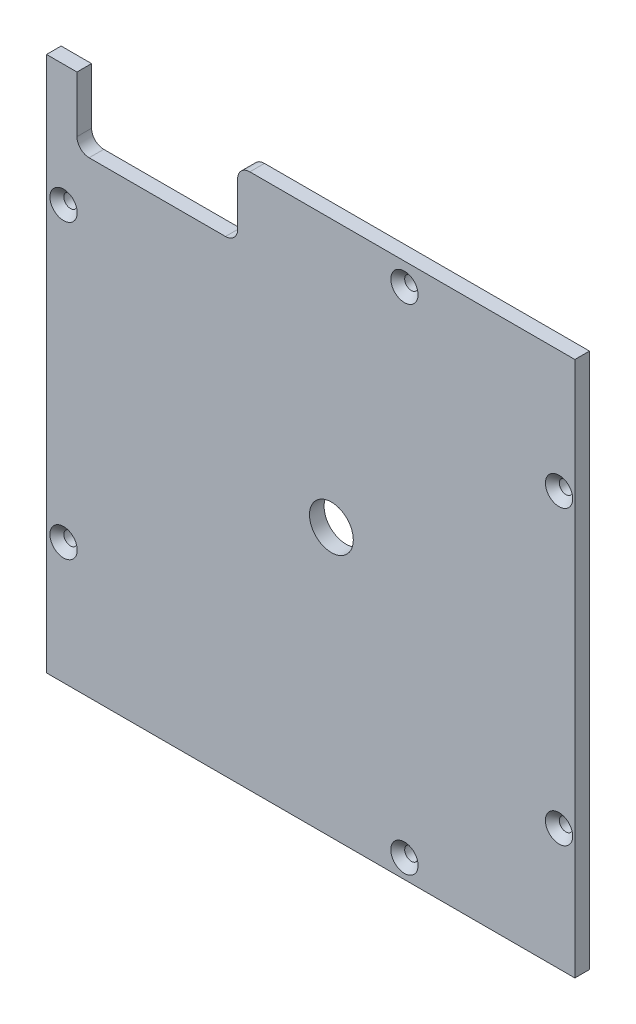
from build123d import *

# Parameters (mm, degrees)
ESBO_O1_W                            = 217
ESBO_O1_H                            = 220
RESSALTO_EXTRUS_O1_DEPTH             = 6
ESCAREADO_PARA_SFHCS_M51_D           = 5.5
ESCAREADO_PARA_SFHCS_M51_CSINK_D     = 11.2
ESCAREADO_PARA_SFHCS_M51_CSINK_ANGLE = 90
CORTE_EXTRUS_O1_REACH                = 162.702
ESBO_O5_R                            = 9
ESBO_O6_W                            = 66
ESBO_O6_H                            = 28
CORTE_EXTRUS_O2_DEPTH                = 161.7015868
FILETE1_R                            = 5


with BuildPart() as part:
    # Esboço1 → Ressalto-extrusão1 (new body)
    with BuildSketch(Plane.XY):
        with Locations((-8.5, 0)):
            Rectangle(ESBO_O1_W, ESBO_O1_H)
    extrude(amount=RESSALTO_EXTRUS_O1_DEPTH)

    # Escareado para SFHCS M51 (through all)
    with Locations(Plane.XY.offset(6)):
        with Locations((-110, -60), (-110, 60), (93.5, 60), (93.5, -60), (30, -102.194888391), (30, 100.827560784)):
            CounterSinkHole(ESCAREADO_PARA_SFHCS_M51_D / 2, ESCAREADO_PARA_SFHCS_M51_CSINK_D / 2, counter_sink_angle=ESCAREADO_PARA_SFHCS_M51_CSINK_ANGLE)

    # Esboço5 → Corte-extrusão1 (cut, up to next)
    with BuildSketch(Plane.XY.offset(6), mode=Mode.PRIVATE) as corte_extrus_o1_sk1:
        with Locations((0, 0.3)):
            Circle(ESBO_O5_R)
    corte_extrus_o1_tool1 = extrude(corte_extrus_o1_sk1.sketch, amount=-CORTE_EXTRUS_O1_REACH, mode=Mode.PRIVATE) & part.part
    add(corte_extrus_o1_tool1.solids().sort_by_distance((0, 0.3, 6))[0], mode=Mode.SUBTRACT)

    # Esboço6 → Corte-extrusão2 (cut, through all)
    with BuildSketch(Plane.XY.offset(6)):
        with Locations((-71.5, 96)):
            Rectangle(ESBO_O6_W, ESBO_O6_H)
    extrude(amount=-CORTE_EXTRUS_O2_DEPTH, mode=Mode.SUBTRACT)

    # Filete1
    filete1_edges = [part.edges().sort_by_distance(p)[0] for p in [
        (-104.5, 82, 3),
        (-38.5, 110, 3),
        (-38.5, 82, 3),
    ]]
    fillet(filete1_edges, radius=FILETE1_R)


solid = part.part
